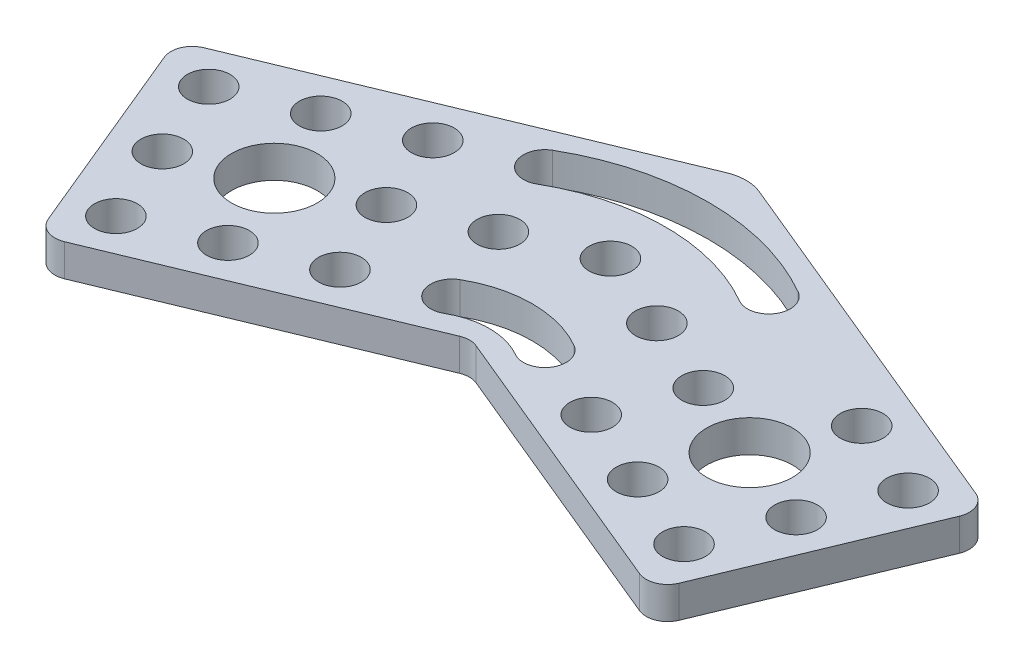
from build123d import *

# Parameters (mm, degrees)
SKETCH1_R           = 2
SKETCH1_R_2         = 4
BOSS_EXTRUDE1_DEPTH = 3


with BuildPart() as part:
    # Sketch1 → Boss-Extrude1 (new body)
    with BuildSketch(Plane(origin=(0, 0, 0), x_dir=(1, 0, 0), z_dir=(0, 1, 0))):
        with BuildLine():
            ThreePointArc((1.530733729, 12.354655732), (0, 12.659137602), (-1.530733729, 12.354655732))
            Line((-1.530733729, 12.354655732), (-36.004105294, -1.92468231))
            ThreePointArc((-36.004105294, -1.92468231), (-37.086497494, -3.007074511), (-37.086497494, -4.53780824))
            Line((-37.086497494, -4.53780824), (-29.432828847, -23.01539889))
            ThreePointArc((-29.432828847, -23.01539889), (-28.350436646, -24.097791091), (-26.819702917, -24.097791091))
            Line((-26.819702917, -24.097791091), (-0.765366865, -13.305731739))
            ThreePointArc((-0.765366865, -13.305731739), (0, -13.153490804), (0.765366865, -13.305731739))
            Line((0.765366865, -13.305731739), (26.819702917, -24.097791091))
            ThreePointArc((26.819702917, -24.097791091), (28.350436646, -24.097791091), (29.432828847, -23.01539889))
            Line((29.432828847, -23.01539889), (37.086497494, -4.53780824))
            ThreePointArc((37.086497494, -4.53780824), (37.086497494, -3.007074511), (36.004105294, -1.92468231))
            Line((36.004105294, -1.92468231), (1.530733729, 12.354655732))
        make_face()
        with BuildLine():
            ThreePointArc((-9.452503719, 2.597517994), (-9.567926339, 2.535823318), (-9.687136854, 2.481809736))
            ThreePointArc((-9.687136854, 2.481809736), (-12.246249202, 3.444991421), (-11.452503719, 6.061619609))
            ThreePointArc((-11.452503719, 6.061619609), (0, 9.130308732), (11.452503719, 6.061619609))
            ThreePointArc((11.452503719, 6.061619609), (12.184554527, 3.329568801), (9.452503719, 2.597517994))
            ThreePointArc((9.452503719, 2.597517994), (4.892975973, 4.486136224), (0, 5.130308732))
            ThreePointArc((0, 5.130308732), (-4.892975973, 4.486136224), (-9.452503719, 2.597517994))
        make_face(mode=Mode.SUBTRACT)
        with Locations(Location((-26.502677581, -19.636906096, 0), (0, 0, 270))):
            Circle(SKETCH1_R, mode=Mode.SUBTRACT)
        with Locations(Location((-19.111641321, -16.575438637, 0), (0, 0, 270))):
            Circle(SKETCH1_R, mode=Mode.SUBTRACT)
        with Locations(Location((-29.56414504, -12.245869836, 0), (0, 0, 270))):
            Circle(SKETCH1_R, mode=Mode.SUBTRACT)
        with Locations(Location((-22.17310878, -9.184402377, 0), (0, 0, 270))):
            Circle(SKETCH1_R_2, mode=Mode.SUBTRACT)
        with Locations(Location((-11.720605061, -13.513971178, 0), (0, 0, 270))):
            Circle(SKETCH1_R, mode=Mode.SUBTRACT)
        with Locations(Location((-14.78207252, -6.122934918, 0), (0, 0, 270))):
            Circle(SKETCH1_R, mode=Mode.SUBTRACT)
        with BuildLine():
            ThreePointArc((-3.329568801, -12.184554527), (-6.061619609, -11.452503719), (-5.329568801, -8.720452911))
            ThreePointArc((-5.329568801, -8.720452911), (0, -7.292399255), (5.329568801, -8.720452911))
            ThreePointArc((5.329568801, -8.720452911), (6.061619609, -11.452503719), (3.329568801, -12.184554527))
            ThreePointArc((3.329568801, -12.184554527), (0, -11.292399255), (-3.329568801, -12.184554527))
        make_face(mode=Mode.SUBTRACT)
        with Locations(Location((26.502677581, -19.636906096, 0), (0, 0, 270))):
            Circle(SKETCH1_R, mode=Mode.SUBTRACT)
        with Locations(Location((19.111641321, -16.575438637, 0), (0, 0, 270))):
            Circle(SKETCH1_R, mode=Mode.SUBTRACT)
        with Locations(Location((11.720605061, -13.513971178, 0), (0, 0, 270))):
            Circle(SKETCH1_R, mode=Mode.SUBTRACT)
        with Locations(Location((14.78207252, -6.122934918, 0), (0, 0, 270))):
            Circle(SKETCH1_R, mode=Mode.SUBTRACT)
        with Locations(Location((29.56414504, -12.245869836, 0), (0, 0, 270))):
            Circle(SKETCH1_R, mode=Mode.SUBTRACT)
        with Locations(Location((22.17310878, -9.184402377, 0), (0, 0, 270))):
            Circle(SKETCH1_R_2, mode=Mode.SUBTRACT)
        with Locations(Location((-32.625612499, -4.854833576, 0), (0, 0, 270))):
            Circle(SKETCH1_R, mode=Mode.SUBTRACT)
        with Locations(Location((-25.234576239, -1.793366117, 0), (0, 0, 270))):
            Circle(SKETCH1_R, mode=Mode.SUBTRACT)
        with Locations(Location((-7.39103626, -3.061467459, 0), (0, 0, 270))):
            Circle(SKETCH1_R, mode=Mode.SUBTRACT)
        with Locations(Location((-17.843539979, 1.268101342, 0), (0, 0, 270))):
            Circle(SKETCH1_R, mode=Mode.SUBTRACT)
        with Locations(Location((0, 0, 0), (0, 0, 270))):
            Circle(SKETCH1_R, mode=Mode.SUBTRACT)
        with Locations(Location((7.39103626, -3.061467459, 0), (0, 0, 270))):
            Circle(SKETCH1_R, mode=Mode.SUBTRACT)
        with Locations(Location((25.234576239, -1.793366117, 0), (0, 0, 270))):
            Circle(SKETCH1_R, mode=Mode.SUBTRACT)
        with Locations(Location((32.625612499, -4.854833576, 0), (0, 0, 270))):
            Circle(SKETCH1_R, mode=Mode.SUBTRACT)
    extrude(amount=BOSS_EXTRUDE1_DEPTH)


solid = part.part
